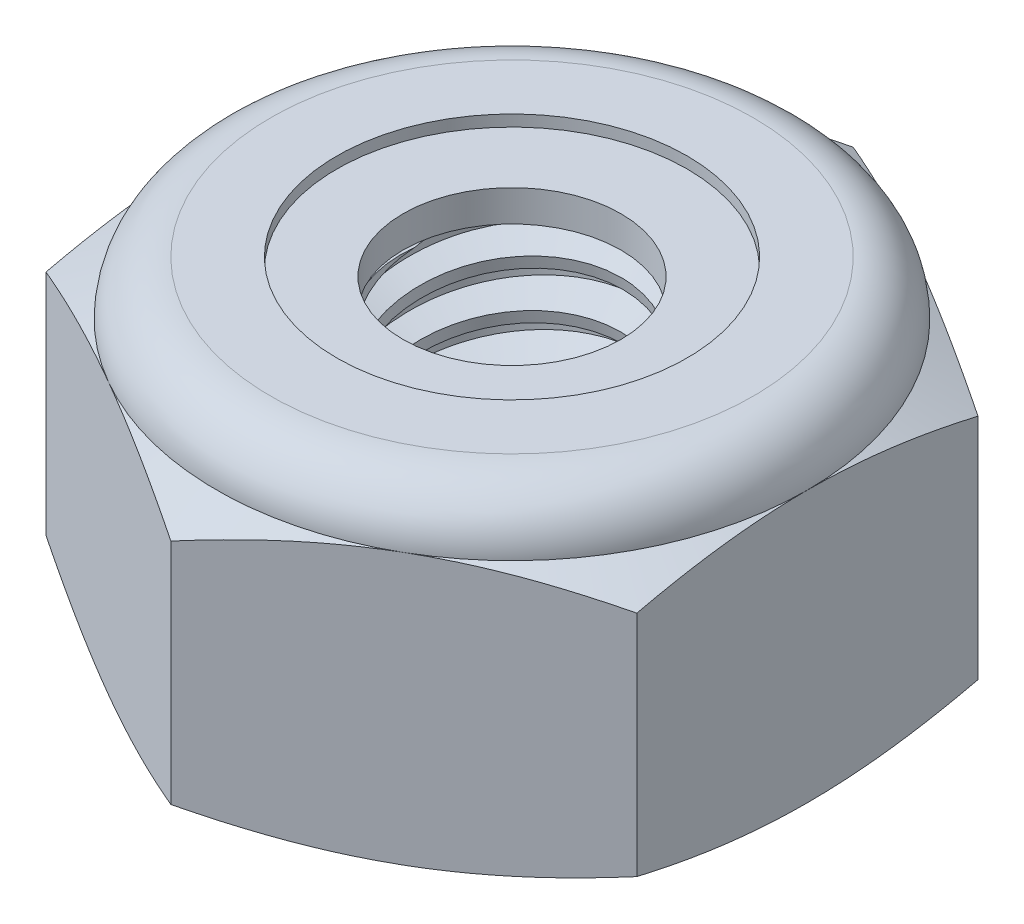
from build123d import *

# Parameters (mm, degrees)
EXTRUDE1_DEPTH      = 4.365625
SKETCH2_W           = 1.7526
SKETCH2_H           = 4.365625
LPATTERN1_COUNT     = 7
LPATTERN1_PITCH     = 0.635
LPATTERN1_COL_COUNT = 2
LPATTERN1_COL_PITCH = 0.635


with BuildPart() as part:
    # Sketch1 → Extrude1 (new body)
    with BuildSketch(Plane(origin=(0, 0, 0), x_dir=(1, 0, 0), z_dir=(0, 1, 0))):
        Polygon((0, 4.582717762), (-3.96875, 2.291358881), (-3.96875, -2.291358881), (0, -4.582717762), (3.96875, -2.291358881), (3.96875, 2.291358881), align=None)
    extrude(amount=EXTRUDE1_DEPTH)

    # Sketch4 → Cut-Revolve2 (revolve, cut)
    with BuildSketch(Plane(origin=(0, 0, 0), x_dir=(0, 0, -1), z_dir=(1, 0, 0)), mode=Mode.PRIVATE) as cut_revolve2_sk:
        Polygon((0, 4.365625), (1.7526, 4.365625), (1.463923281, 4.231012835), (1.463923281, 0.134612165), (1.7526, 0), (0, 0), align=None)
    revolve(cut_revolve2_sk.sketch.rotate(Axis((0, 4.365625, 0), (0, 1, 0)), 54.615260481), axis=Axis((0, 4.365625, 0), (0, 1, 0)), mode=Mode.SUBTRACT)


with BuildPart() as body_2:
    # Sketch2 → Revolve1 (revolve)
    with BuildSketch(Plane(origin=(0, 0, 0), x_dir=(0, 0, -1), z_dir=(1, 0, 0))):
        with Locations((0.8763, 2.1828125)):
            Rectangle(SKETCH2_W, SKETCH2_H)
    revolve(axis=Axis((0, -1.7526, 0), (0, 1, 0)))

    # Sketch3 → Cut-Revolve1 (revolve, cut)
    with BuildSketch(Plane(origin=(0, 0, 0), x_dir=(0, 0, -1), z_dir=(1, 0, 0)), mode=Mode.PRIVATE) as cut_revolve1_sk:
        Polygon((1.766749224, 4.287521286), (1.865793788, 3.74079529), (1.492221728, 3.874786639), (1.463923281, 4.030994067), align=None)
    cut_revolve1 = revolve(cut_revolve1_sk.sketch.rotate(Axis((0, 4.365625, 0.12327924), (0, -0.9839837950921836, -0.17825793389351216)), 180), axis=Axis((0, 4.365625, 0.12327924), (0, -0.9839837950921836, -0.17825793389351216)), mode=Mode.SUBTRACT)

    # LPattern1: Cut-Revolve1 ×7
    with Locations(*[(0, -i * LPATTERN1_PITCH, 0) for i in range(1, LPATTERN1_COUNT)]):
        add(cut_revolve1, mode=Mode.SUBTRACT)

    # LPattern1 col: Cut-Revolve1 ×2
    with Locations(*[(0, i * LPATTERN1_COL_PITCH, 0) for i in range(1, LPATTERN1_COL_COUNT)]):
        add(cut_revolve1, mode=Mode.SUBTRACT)


with BuildPart() as part_1:
    add(part.part)

    # Combine1: cut body 2
    add(body_2.part, mode=Mode.SUBTRACT)

    # Sketch5 → Cut-Revolve3 (revolve, cut)
    with BuildSketch(Plane(origin=(0, 0, 0), x_dir=(0, 0, -1), z_dir=(1, 0, 0)), mode=Mode.PRIVATE) as cut_revolve3_sk:
        with BuildLine():
            Line((0, 0), (3.96875, 0))
            Line((3.96875, 0), (4.582717762, 0.286297869))
            Line((4.582717762, 0.286297869), (4.582717762, 3.351722964))
            Line((4.582717762, 3.351722964), (3.96875, 3.638020833))
            ThreePointArc((3.96875, 3.638020833), (3.755639674, 4.152514674), (3.241145833, 4.365625))
            Line((3.241145833, 4.365625), (3.241145833, 5.635625))
            Line((3.241145833, 5.635625), (5.852717762, 5.635625))
            Line((5.852717762, 5.635625), (5.852717762, -1.27))
            Line((5.852717762, -1.27), (0, -1.27))
            Line((0, -1.27), (0, 0))
        make_face()
    revolve(cut_revolve3_sk.sketch.rotate(Axis((0, 0, 0), (0, 1, 0)), 54.615260481), axis=Axis((0, 0, 0), (0, 1, 0)), mode=Mode.SUBTRACT)

    # Sketch6 → Cut-Revolve4 (revolve, cut)
    with BuildSketch(Plane(origin=(0, 0, 0), x_dir=(0, 0, -1), z_dir=(1, 0, 0)), mode=Mode.PRIVATE) as cut_revolve4_sk:
        with BuildLine():
            Line((0, 3.638020833), (3.81635, 3.638020833))
            ThreePointArc((3.81635, 3.638020833), (3.6478766, 4.0447516), (3.241145833, 4.213225))
            Line((3.241145833, 4.213225), (2.352534557, 4.213225))
            Line((2.352534557, 4.213225), (2.352534557, 5.635625))
            Line((2.352534557, 5.635625), (0, 5.635625))
            Line((0, 5.635625), (0, 3.638020833))
        make_face()
    revolve(cut_revolve4_sk.sketch.rotate(Axis((0, 5.635625, 0), (0, 1, 0)), 54.615260481), axis=Axis((0, 5.635625, 0), (0, 1, 0)), mode=Mode.SUBTRACT)


with BuildPart() as body_2_2:
    # Sketch7 → Revolve2 (revolve)
    with BuildSketch(Plane(origin=(0, 0, 0), x_dir=(0, 0, -1), z_dir=(1, 0, 0))):
        with BuildLine():
            Line((1.463923281, 3.714220833), (3.734297654, 3.714220833))
            ThreePointArc((3.734297654, 3.714220833), (3.565938876, 4.016854092), (3.241145833, 4.137025))
            Line((3.241145833, 4.137025), (1.463923281, 4.137025))
            Line((1.463923281, 4.137025), (1.463923281, 3.714220833))
        make_face()
    revolve(axis=Axis((0, 3.714220833, 0), (0, 1, 0)))


solid = Compound([part_1.part, body_2_2.part])
